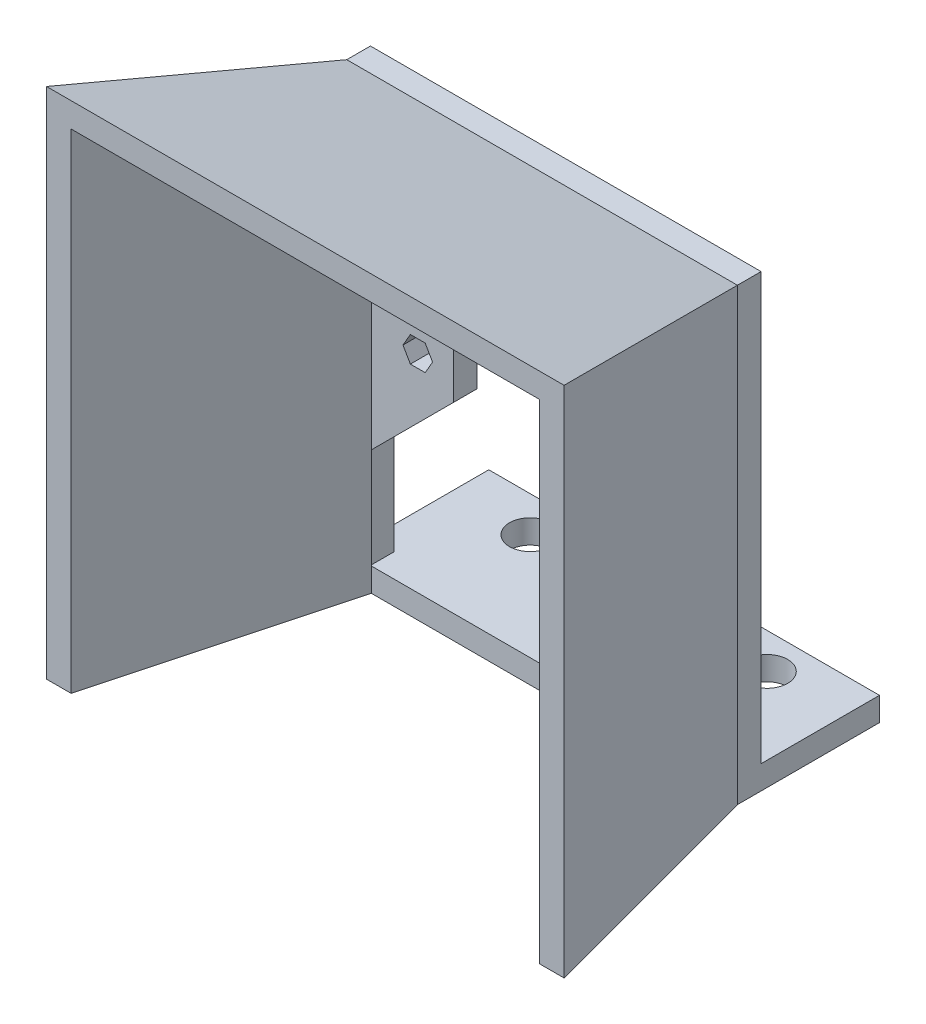
from build123d import *

# Parameters (mm, degrees)
BOSS_EXTRUDE1_DEPTH = 2
SKETCH2_W           = 33
SKETCH2_H           = 38
BOSS_EXTRUDE2_DEPTH = 20
BOSS_EXTRUDE2_DRAFT = -15
SHELL1_T            = -2
SKETCH3_W           = 33
SKETCH3_H           = 12
BOSS_EXTRUDE3_DEPTH = 2
SKETCH4_R           = 1.75
CUT_EXTRUDE1_DEPTH  = 61.547313622
SKETCH5_W           = 43.717967698
SKETCH5_H           = 20
CUT_EXTRUDE2_DEPTH  = 62.93071227


with BuildPart() as part:
    # Sketch1 → Boss-Extrude1 (new body)
    with BuildSketch(Plane.XY):
        Polygon((0, 0), (0, 38), (33, 38), (33, 0), (31, 0), (31, 10.417468245), (24, 17.417468245), (24, 34), (9, 34), (9, 17.417468245), (2, 10.417468245), (2, 0), align=None)
        Polygon((7.25, 32), (6.625, 33.082531755), (5.375, 33.082531755), (4.75, 32), (5.375, 30.917468245), (6.625, 30.917468245), align=None, mode=Mode.SUBTRACT)
        Polygon((7.25, 19.5), (6.625, 20.582531755), (5.375, 20.582531755), (4.75, 19.5), (5.375, 18.417468245), (6.625, 18.417468245), align=None, mode=Mode.SUBTRACT)
        Polygon((25.75, 19.5), (26.375, 18.417468245), (27.625, 18.417468245), (28.25, 19.5), (27.625, 20.582531755), (26.375, 20.582531755), align=None, mode=Mode.SUBTRACT)
        Polygon((28.25, 32), (27.625, 33.082531755), (26.375, 33.082531755), (25.75, 32), (26.375, 30.917468245), (27.625, 30.917468245), align=None, mode=Mode.SUBTRACT)
    extrude(amount=BOSS_EXTRUDE1_DEPTH)

    # Sketch3 → Boss-Extrude3 (add)
    with BuildSketch(Plane.XZ):
        with Locations((16.5, -4)):
            Rectangle(SKETCH3_W, SKETCH3_H)
    extrude(amount=-BOSS_EXTRUDE3_DEPTH)

    # Sketch4 → Cut-Extrude1 (cut, through all)
    with BuildSketch(Plane(origin=(0, 2, 0), x_dir=(1, 0, 0), z_dir=(0, 1, 0))):
        with Locations((26.5, 7)):
            Circle(SKETCH4_R)
        with Locations((6.5, 7)):
            Circle(SKETCH4_R)
    extrude(amount=-CUT_EXTRUDE1_DEPTH, mode=Mode.SUBTRACT)


with BuildPart() as body_2:
    # Sketch2 → Boss-Extrude2 (with draft: the straight prism first)
    with BuildSketch(Plane.XY.offset(2)):
        with Locations((16.5, 19)):
            Rectangle(SKETCH2_W, SKETCH2_H)
    extrude(amount=BOSS_EXTRUDE2_DEPTH)
    # Boss-Extrude2: the draft: its side faces are tilted about the plane it starts from
    boss_extrude2_sides = [body_2.faces().sort_by_distance(p)[0] for p in [
        (33, 19, 12),
        (16.5, 38, 12),
        (0, 19, 12),
        (16.5, 0, 12),
    ]]
    draft(boss_extrude2_sides, Plane.XY.offset(2), BOSS_EXTRUDE2_DRAFT)

    # Shell1
    shell1_openings = [body_2.faces().sort_by_distance(p)[0] for p in [
        (16.5, -2.804272376, 12.465686984),
        (16.5, 19, 22),
        (16.5, 19, 2),
    ]]
    offset(amount=SHELL1_T, openings=shell1_openings, kind=Kind.INTERSECTION)

    # Sketch5 → Cut-Extrude2 (cut, through all)
    with BuildSketch(Plane.XZ):
        with Locations((16.5, 12)):
            Rectangle(SKETCH5_W, SKETCH5_H)
    extrude(amount=CUT_EXTRUDE2_DEPTH, mode=Mode.SUBTRACT)

    # Combine1: union part
    add(part.part)


solid = body_2.part
